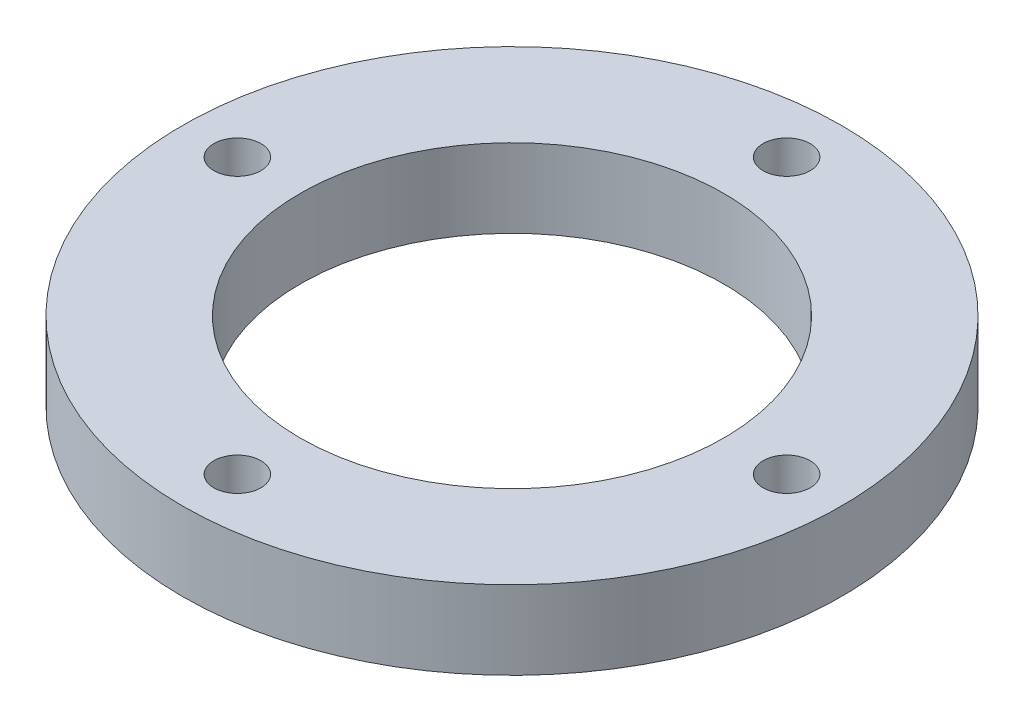
from build123d import *

# Parameters (mm, degrees)
SKETCH_1_R      = 21
SKETCH_1_R_2    = 13.5
SKETCH_1_R_3    = 1.5
EXTRUDE_1_DEPTH = 2.5


with BuildPart() as part:
    # 草图1 → 凸台-拉伸1 (new, symmetric)
    with BuildSketch(Plane(origin=(0, 0, 0), x_dir=(1, 0, 0), z_dir=(0, 1, 0))):
        with Locations(Location((0, 0, 0), (0, 0, 270))):
            Circle(SKETCH_1_R)
        with Locations(Location((0, 0, 0), (0, 0, 270))):
            Circle(SKETCH_1_R_2, mode=Mode.SUBTRACT)
        with Locations(Location((0, 17.5, 0), (0, 0, 270))):
            Circle(SKETCH_1_R_3, mode=Mode.SUBTRACT)
        with Locations(Location((17.5, 0, 0), (0, 0, 270))):
            Circle(SKETCH_1_R_3, mode=Mode.SUBTRACT)
        with Locations(Location((0, -17.5, 0), (0, 0, 270))):
            Circle(SKETCH_1_R_3, mode=Mode.SUBTRACT)
        with Locations(Location((-17.5, 0, 0), (0, 0, 270))):
            Circle(SKETCH_1_R_3, mode=Mode.SUBTRACT)
    extrude(amount=EXTRUDE_1_DEPTH, both=True)


solid = part.part
